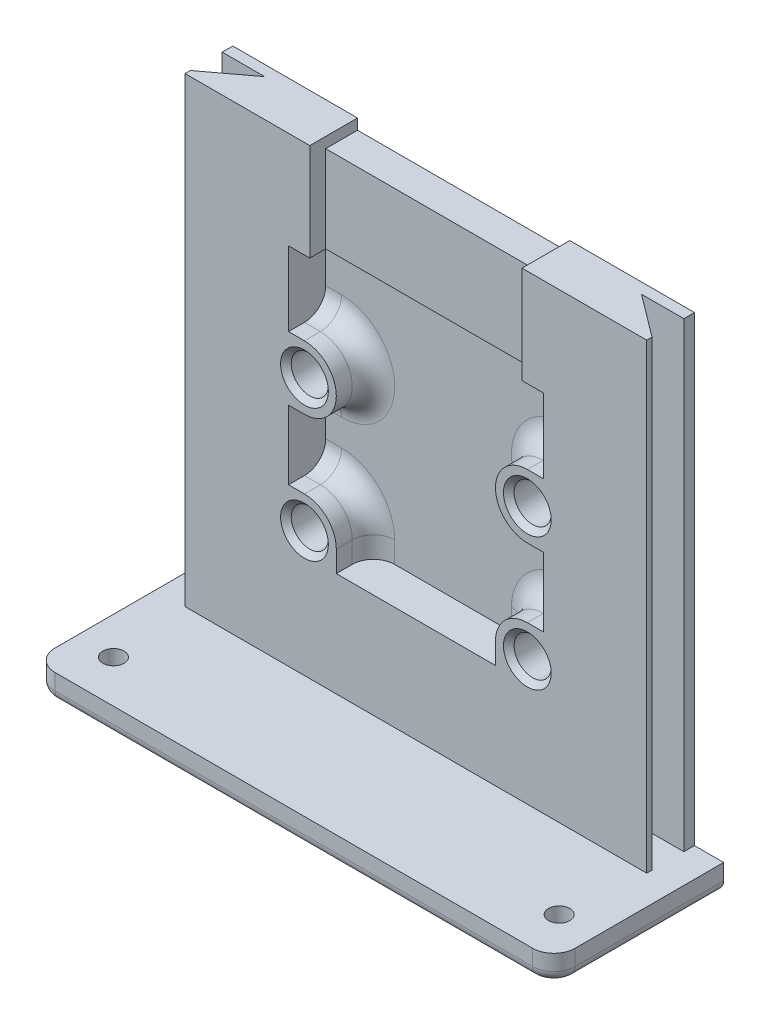
from build123d import *

# Parameters (mm, degrees)
ESQUISSE1_W             = 43.5
ESQUISSE1_H             = 43.5
BOSS_EXTRU_1_DEPTH      = 3.5
ESQUISSE3_W             = 24
ESQUISSE3_H             = 24.5
ENL_V_MAT_EXTRU_1_DEPTH = 3.5
ENL_V_MAT_EXTRU_3_DEPTH = 43.5
ESQUISSE5_W             = 20
ESQUISSE5_H             = 9.18
ENL_V_MAT_EXTRU_4_DEPTH = 1.5
BOSS_EXTRU_2_DEPTH      = 3.5
ESQUISSE8_R             = 1.75
ENL_V_MAT_EXTRU_5_DEPTH = 3.5
ESQUISSE9_W             = 43.5
ESQUISSE9_H             = 43.5
BOSS_EXTRU_3_DEPTH      = 1
CONG_2_R                = 2
CHANFREIN1_SIZE         = 0.5
ESQUISSE10_W            = 20
ESQUISSE10_H            = 1
ENL_V_MAT_EXTRU_6_DEPTH = 3
ESQUISSE11_W            = 49
ESQUISSE11_H            = 16
BOSS_EXTRU_4_DEPTH      = 2.5
ESQUISSE12_R            = 1
ENL_V_MAT_EXTRU_7_DEPTH = 2.5
CONG_3_R                = 2
CONG_4_R                = 1
CHANFREIN2_SIZE         = 0.5


with BuildPart() as part:
    # Esquisse1 → Boss.-Extru.1 (new body)
    with BuildSketch(Plane.XY):
        with Locations((21.75, 21.75)):
            Rectangle(ESQUISSE1_W, ESQUISSE1_H)
    extrude(amount=BOSS_EXTRU_1_DEPTH)

    # Esquisse3 → Enlèv. mat.-Extru.1 (cut)
    with BuildSketch(Plane.XY.offset(3.5)):
        with Locations((21.75, 22.07)):
            Rectangle(ESQUISSE3_W, ESQUISSE3_H)
    extrude(amount=-ENL_V_MAT_EXTRU_1_DEPTH, mode=Mode.SUBTRACT)

    # Esquisse4 → Enlèv. mat.-Extru.3 (cut)
    with BuildSketch(Plane.XZ):
        Polygon((0, 0), (0, 3), (4, 0), align=None)
        Polygon((43.5, 3), (39.5, 0), (43.5, 0), align=None)
    extrude(amount=-ENL_V_MAT_EXTRU_3_DEPTH, mode=Mode.SUBTRACT)

    # Esquisse5 → Enlèv. mat.-Extru.4 (cut)
    with BuildSketch(Plane.XY.offset(3.5)):
        with Locations((21.75, 38.91)):
            Rectangle(ESQUISSE5_W, ESQUISSE5_H)
    extrude(amount=-ENL_V_MAT_EXTRU_4_DEPTH, mode=Mode.SUBTRACT)

    # Esquisse6 → Boss.-Extru.2 (add)
    with BuildSketch(Plane.XY.offset(3.5)):
        with BuildLine():
            Line((11.25, 27.32), (9.75, 27.32))
            Line((9.75, 27.32), (9.75, 21.32))
            Line((9.75, 21.32), (11.25, 21.32))
            ThreePointArc((11.25, 21.32), (14.25, 24.32), (11.25, 27.32))
        make_face()
        with BuildLine():
            Line((11.25, 14.82), (9.75, 14.82))
            Line((9.75, 14.82), (9.75, 9.82))
            Line((9.75, 9.82), (14.25, 9.82))
            Line((14.25, 9.82), (14.25, 11.82))
            ThreePointArc((14.25, 11.82), (13.371320344, 13.941320344), (11.25, 14.82))
        make_face()
        with BuildLine():
            Line((29.25, 11.82), (29.25, 9.82))
            Line((29.25, 9.82), (33.75, 9.82))
            Line((33.75, 9.82), (33.75, 14.82))
            Line((33.75, 14.82), (32.25, 14.82))
            ThreePointArc((32.25, 14.82), (30.128679656, 13.941320344), (29.25, 11.82))
        make_face()
        with BuildLine():
            Line((32.25, 27.32), (33.75, 27.32))
            Line((33.75, 27.32), (33.75, 21.32))
            Line((33.75, 21.32), (32.25, 21.32))
            ThreePointArc((32.25, 21.32), (29.25, 24.32), (32.25, 27.32))
        make_face()
    extrude(amount=-BOSS_EXTRU_2_DEPTH)

    # Esquisse8 → Enlèv. mat.-Extru.5 (cut)
    with BuildSketch(Plane.XY.offset(3.5)):
        with Locations((11.25, 24.32)):
            Circle(ESQUISSE8_R)
        with Locations((32.25, 24.32)):
            Circle(ESQUISSE8_R)
        with Locations((32.25, 11.82)):
            Circle(ESQUISSE8_R)
        with Locations((11.25, 11.82)):
            Circle(ESQUISSE8_R)
    extrude(amount=-ENL_V_MAT_EXTRU_5_DEPTH, mode=Mode.SUBTRACT)

    # Esquisse9 → Boss.-Extru.3 (add)
    with BuildSketch(Plane(origin=(0, 0, 0), x_dir=(-1, 0, 0), z_dir=(0, 0, -1))):
        with Locations((-21.75, 21.75)):
            Rectangle(ESQUISSE9_W, ESQUISSE9_H)
    extrude(amount=BOSS_EXTRU_3_DEPTH)

    # Congé2
    cong_2_edges = [part.edges().sort_by_distance(p)[0] for p in [
        (29.25, 24.32, 0),
        (33, 27.32, 0),
        (33, 21.32, 0),
        (14.25, 24.32, 0),
        (10.5, 21.32, 0),
        (10.5, 27.32, 0),
        (13.371320344, 13.941320344, 0),
        (14.25, 10.82, 0),
        (10.5, 14.82, 0),
        (30.128679656, 13.941320344, 0),
        (33, 14.82, 0),
        (29.25, 10.82, 0),
    ]]
    fillet(cong_2_edges, radius=CONG_2_R)

    # Chanfrein1
    chanfrein1_edges = [part.edges().sort_by_distance(p)[0] for p in [
        (9.5, 11.82, 3.5),
        (30.5, 11.82, 3.5),
        (30.5, 24.32, 3.5),
        (9.5, 24.32, 3.5),
    ]]
    chamfer(chanfrein1_edges, length=CHANFREIN1_SIZE)

    # Esquisse10 → Enlèv. mat.-Extru.6 (cut)
    with BuildSketch(Plane.XY.offset(2)):
        with Locations((21.75, 43)):
            Rectangle(ESQUISSE10_W, ESQUISSE10_H)
    extrude(amount=-ENL_V_MAT_EXTRU_6_DEPTH, mode=Mode.SUBTRACT)

    # Esquisse11 → Boss.-Extru.4 (add)
    with BuildSketch(Plane.XZ):
        with Locations((21.75, 7)):
            Rectangle(ESQUISSE11_W, ESQUISSE11_H)
    extrude(amount=BOSS_EXTRU_4_DEPTH)

    # Esquisse12 → Enlèv. mat.-Extru.7 (cut)
    with BuildSketch(Plane.XZ.offset(2.5)):
        with Locations(Location((0.75, 11, 0), (0, 0, 270))):
            Circle(ESQUISSE12_R)
        with Locations(Location((42.75, 11, 0), (0, 0, 270))):
            Circle(ESQUISSE12_R)
    extrude(amount=-ENL_V_MAT_EXTRU_7_DEPTH, mode=Mode.SUBTRACT)

    # Congé3
    cong_3_edges = [part.edges().sort_by_distance(p)[0] for p in [
        (-2.75, -1.25, 15),
        (46.25, -1.25, 15),
    ]]
    fillet(cong_3_edges, radius=CONG_3_R)

    # Congé4
    cong_4_edges = [part.edges().sort_by_distance(p)[0] for p in [
        (46.25, -2.5, 6),
        (-2.75, -2.5, 6),
        (21.75, -2.5, 15),
        (45.664213562, -2.5, 14.414213562),
        (-2.164213562, -2.5, 14.414213562),
    ]]
    fillet(cong_4_edges, radius=CONG_4_R)

    # Chanfrein2
    chanfrein2_edges = [part.edges().sort_by_distance(p)[0] for p in [
        (0.75, -2.5, 12),
        (42.75, -2.5, 12),
    ]]
    chamfer(chanfrein2_edges, length=CHANFREIN2_SIZE)


solid = part.part
